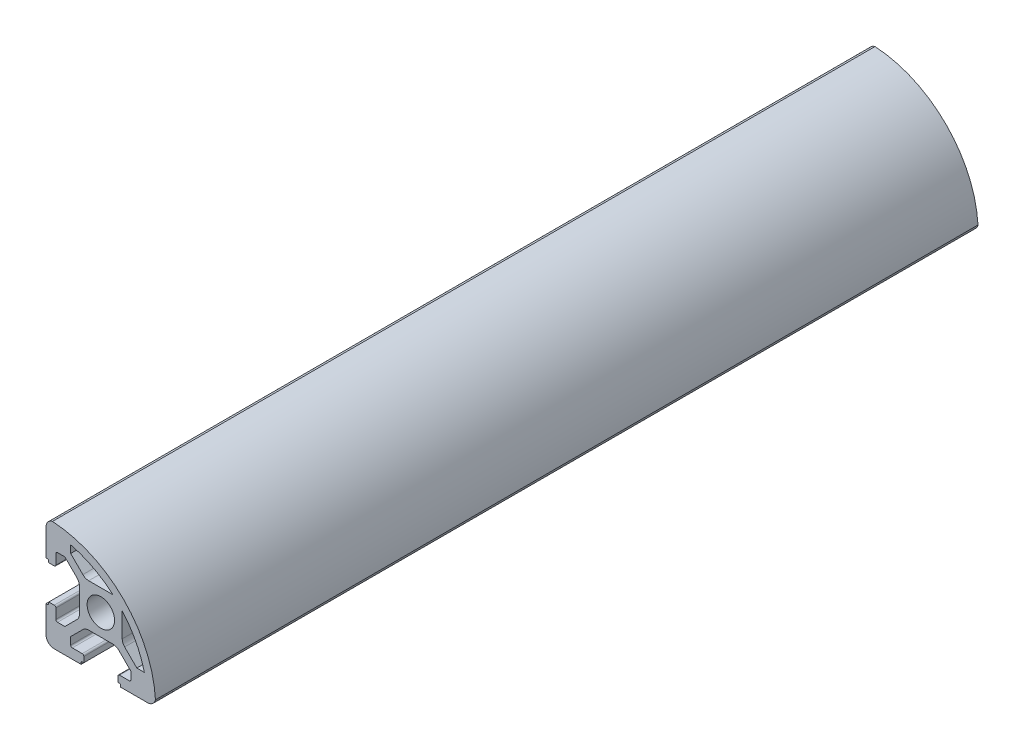
from build123d import *

# Parameters (mm, degrees)
SKETCH_1_R      = 2.5
EXTRUDE_1_DEPTH = 150


with BuildPart() as part:
    # 草图1 → 凸台-拉伸1 (new body)
    with BuildSketch(Plane.XY):
        with BuildLine():
            ThreePointArc((-8.944458369, 9.930115847), (-9.792033903, 9.405190523), (-10.123344197, 8.464890373))
            Line((-10.123344197, 8.464890373), (-10.123344197, 3.564890373))
            Line((-10.123344197, 3.564890373), (-9.823344197, 3.564890373))
            ThreePointArc((-9.823344197, 3.564890373), (-9.681922841, 3.50631173), (-9.623344197, 3.364890373))
            Line((-9.623344197, 3.364890373), (-9.623344197, 3.064890373))
            Line((-9.623344197, 3.064890373), (-8.623344197, 3.064890373))
            ThreePointArc((-8.623344197, 3.064890373), (-8.411212162, 3.152758339), (-8.323344197, 3.364890373))
            Line((-8.323344197, 3.364890373), (-8.323344197, 5.164890373))
            ThreePointArc((-8.323344197, 5.164890373), (-8.235476231, 5.377022408), (-8.023344197, 5.464890373))
            Line((-8.023344197, 5.464890373), (-6.683344197, 5.464890373))
            Line((-6.683344197, 5.464890373), (-4.462684025, 3.244230202))
            ThreePointArc((-4.462684025, 3.244230202), (-4.137524898, 2.757595178), (-4.023344197, 2.18357003))
            Line((-4.023344197, 2.18357003), (-4.023344197, -2.253789283))
            ThreePointArc((-4.023344197, -2.253789283), (-4.137524898, -2.827814432), (-4.462684025, -3.314449455))
            Line((-4.462684025, -3.314449455), (-6.683344197, -5.535109627))
            Line((-6.683344197, -5.535109627), (-8.023344197, -5.535109627))
            ThreePointArc((-8.023344197, -5.535109627), (-8.235476231, -5.447241661), (-8.323344197, -5.235109627))
            Line((-8.323344197, -5.235109627), (-8.323344197, -3.435109627))
            ThreePointArc((-8.323344197, -3.435109627), (-8.411212162, -3.222977592), (-8.623344197, -3.135109627))
            Line((-8.623344197, -3.135109627), (-9.623344197, -3.135109627))
            Line((-9.623344197, -3.135109627), (-9.623344197, -3.435109627))
            ThreePointArc((-9.623344197, -3.435109627), (-9.681922841, -3.576530983), (-9.823344197, -3.635109627))
            Line((-9.823344197, -3.635109627), (-10.123344197, -3.635109627))
            Line((-10.123344197, -3.635109627), (-10.123344197, -8.535109627))
            ThreePointArc((-10.123344197, -8.535109627), (-9.684004369, -9.595769798), (-8.623344197, -10.035109627))
            Line((-8.623344197, -10.035109627), (-3.723344197, -10.035109627))
            Line((-3.723344197, -10.035109627), (-3.723344197, -9.735109627))
            ThreePointArc((-3.723344197, -9.735109627), (-3.664765553, -9.59368827), (-3.523344197, -9.535109627))
            Line((-3.523344197, -9.535109627), (-3.223344197, -9.535109627))
            Line((-3.223344197, -9.535109627), (-3.223344197, -8.535109627))
            ThreePointArc((-3.223344197, -8.535109627), (-3.311212162, -8.322977592), (-3.523344197, -8.235109627))
            Line((-3.523344197, -8.235109627), (-5.323344197, -8.235109627))
            ThreePointArc((-5.323344197, -8.235109627), (-5.535476231, -8.147241661), (-5.623344197, -7.935109627))
            Line((-5.623344197, -7.935109627), (-5.623344197, -6.595109627))
            Line((-5.623344197, -6.595109627), (-3.402684025, -4.374449455))
            ThreePointArc((-3.402684025, -4.374449455), (-2.916049002, -4.049290328), (-2.342023853, -3.935109627))
            Line((-2.342023853, -3.935109627), (2.09533546, -3.935109627))
            ThreePointArc((2.09533546, -3.935109627), (2.669360608, -4.049290328), (3.155995631, -4.374449455))
            Line((3.155995631, -4.374449455), (5.376655803, -6.595109627))
            Line((5.376655803, -6.595109627), (5.376655803, -7.935109627))
            ThreePointArc((5.376655803, -7.935109627), (5.288787838, -8.147241661), (5.076655803, -8.235109627))
            Line((5.076655803, -8.235109627), (3.276655803, -8.235109627))
            ThreePointArc((3.276655803, -8.235109627), (3.064523769, -8.322977592), (2.976655803, -8.535109627))
            Line((2.976655803, -8.535109627), (2.976655803, -9.535109627))
            Line((2.976655803, -9.535109627), (3.276655803, -9.535109627))
            ThreePointArc((3.276655803, -9.535109627), (3.418077159, -9.59368827), (3.476655803, -9.735109627))
            Line((3.476655803, -9.735109627), (3.476655803, -10.035109627))
            Line((3.476655803, -10.035109627), (8.376655803, -10.035109627))
            ThreePointArc((8.376655803, -10.035109627), (9.316955952, -9.703799333), (9.841881277, -8.856223799))
            ThreePointArc((9.841881277, -8.856223799), (4.018791427, 4.107025997), (-8.944458369, 9.930115847))
        make_face()
        with BuildLine():
            ThreePointArc((7.820216628, -5.531930203), (7.798494154, -5.534313715), (7.776655803, -5.535109627))
            Line((7.776655803, -5.535109627), (6.436655803, -5.535109627))
            Line((6.436655803, -5.535109627), (4.215995631, -3.314449455))
            ThreePointArc((4.215995631, -3.314449455), (3.890836504, -2.827814432), (3.776655803, -2.253789283))
            Line((3.776655803, -2.253789283), (3.776655803, 2.173084343))
            ThreePointArc((3.776655803, 2.173084343), (6.257892136, -1.4383023), (7.820216628, -5.531930203))
        make_face(mode=Mode.SUBTRACT)
        with BuildLine():
            ThreePointArc((-5.620164773, 7.908451198), (-1.52653687, 6.346126706), (2.084849773, 3.864890373))
            Line((2.084849773, 3.864890373), (-2.342023853, 3.864890373))
            ThreePointArc((-2.342023853, 3.864890373), (-2.916049002, 3.979071075), (-3.402684025, 4.304230202))
            Line((-3.402684025, 4.304230202), (-5.623344197, 6.524890373))
            Line((-5.623344197, 6.524890373), (-5.623344197, 7.864890373))
            ThreePointArc((-5.623344197, 7.864890373), (-5.622548285, 7.886728724), (-5.620164773, 7.908451198))
        make_face(mode=Mode.SUBTRACT)
        with Locations((-0.123344197, -0.035109627)):
            Circle(SKETCH_1_R, mode=Mode.SUBTRACT)
    extrude(amount=EXTRUDE_1_DEPTH)


solid = part.part
